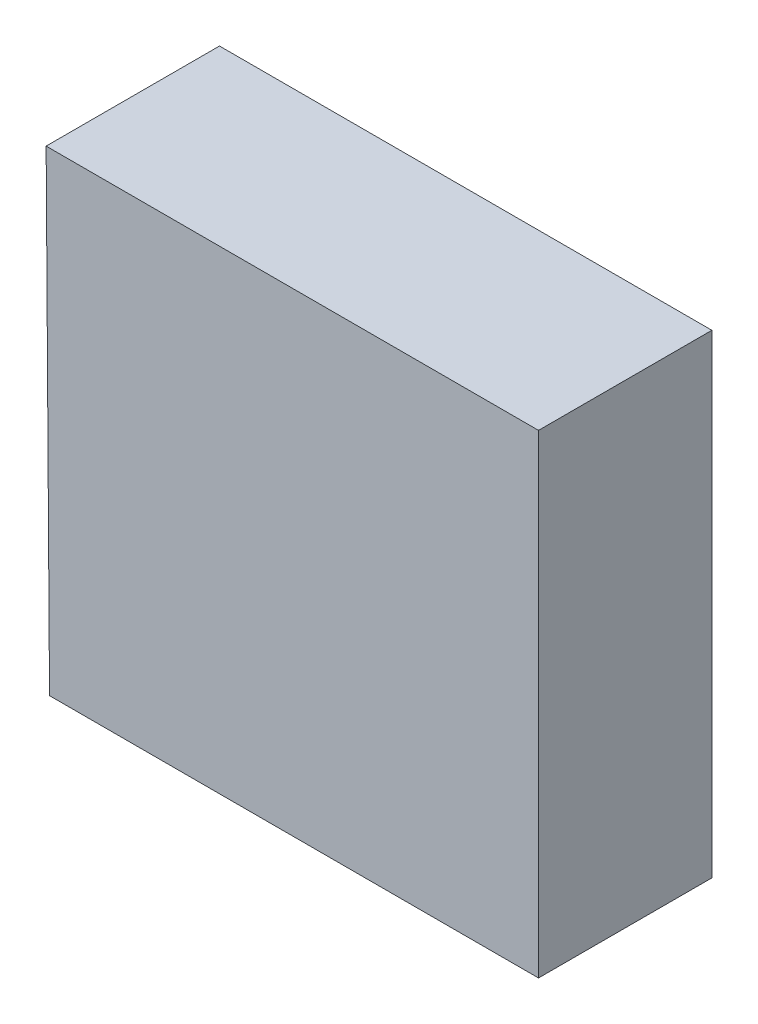
from build123d import *

# Parameters (mm, degrees)
COMPONENT_OUTLINE_DEPTH = 3.89001


with BuildPart() as part:
    # Sketch1 → Component_Outline (new body)
    with BuildSketch(Plane.XY):
        Polygon((8.1788, 5.3086), (8.1788, -5.334), (-2.794, -5.334), (-2.8702, 5.3086), align=None)
    extrude(amount=COMPONENT_OUTLINE_DEPTH)


solid = part.part
